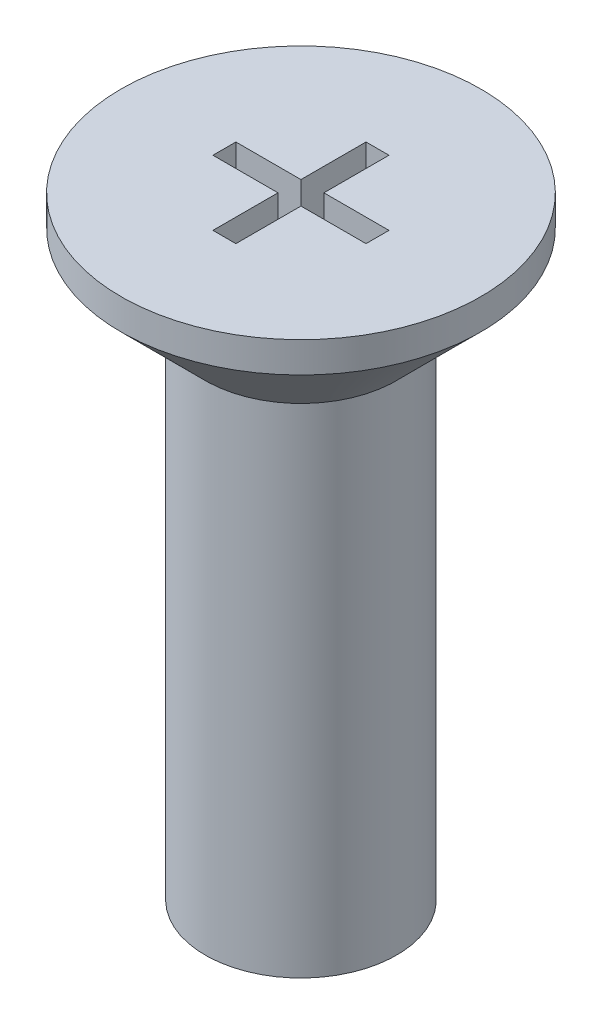
from build123d import *

# Parameters (mm, degrees)
CUT_EXTRUDE1_DEPTH = 1


with BuildPart() as part:
    # Sketch1 → Revolve1 (revolve)
    with BuildSketch(Plane.XY, mode=Mode.PRIVATE) as revolve1_sk:
        Polygon((0, 0), (1.25, 0), (1.25, 6.5), (2.35, 7.6), (2.35, 8), (0, 8), align=None)
    revolve(revolve1_sk.sketch.rotate(Axis((0, 8, 0), (0, -1, 0)), 180), axis=Axis((0, 8, 0), (0, -1, 0)))

    # Sketch2 → Cut-Extrude1 (cut)
    with BuildSketch(Plane(origin=(0, 8, 0), x_dir=(1, 0, 0), z_dir=(0, 1, 0))):
        Polygon((0, 1), (0.15, 1), (0.15, 0.15), (1, 0.15), (1, -0.15), (0.15, -0.15), (0.15, -1), (-0.15, -1), (-0.15, -0.15), (-1, -0.15), (-1, 0.15), (-0.15, 0.15), (-0.15, 1), align=None)
    extrude(amount=-CUT_EXTRUDE1_DEPTH, mode=Mode.SUBTRACT)


solid = part.part
